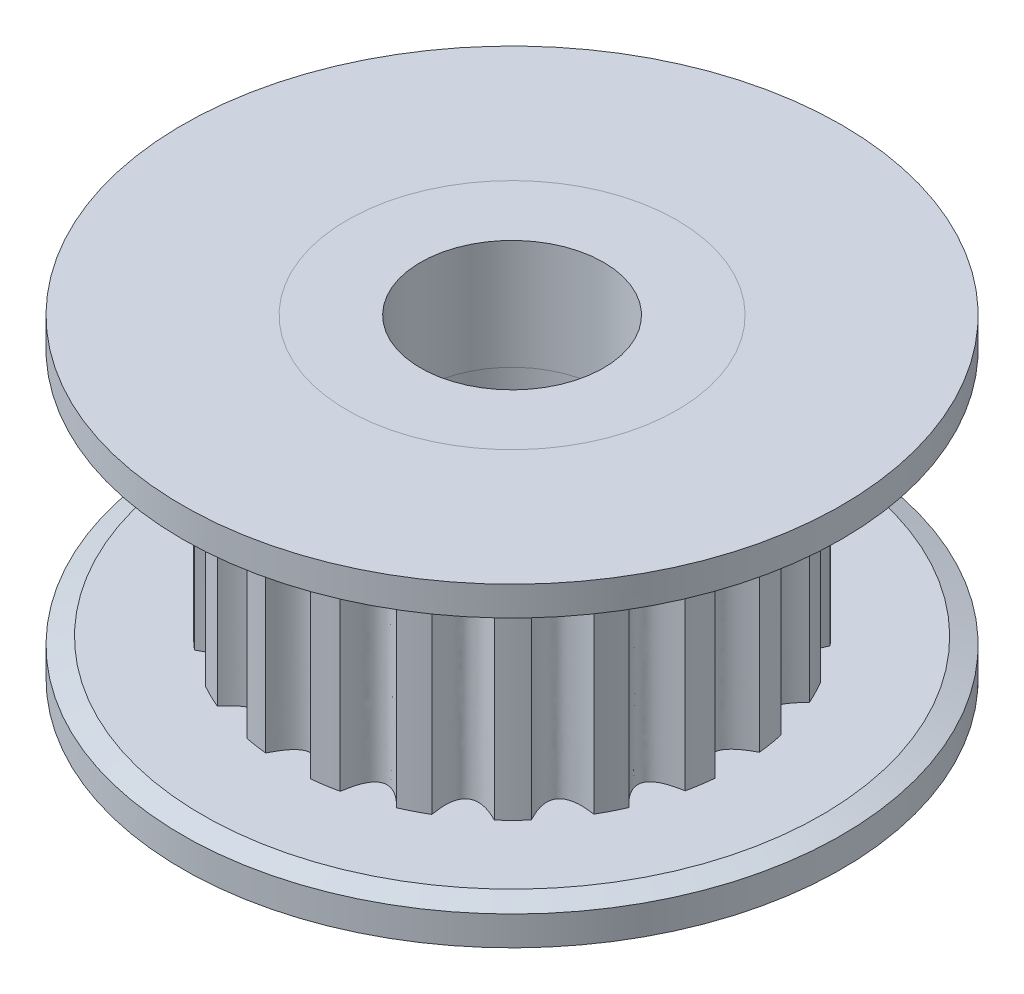
from build123d import *

# Parameters (mm, degrees)
CHANFRO1_SIZE         = 0.2
CHANFRO1_SIZE2        = 0.549495484
CHANFRO2_SIZE         = 0.2
CHANFRO2_SIZE2        = 0.549495484
ESBO_O2_W             = 2
ESBO_O2_H             = 3
CORTE_EXTRUS_O1_DEPTH = 6.6


with BuildPart() as part:
    # Esboço1 → Revolução1 (revolve)
    with BuildSketch(Plane.XY, mode=Mode.PRIVATE) as revolu_o1_sk:
        Polygon((-4.5, 0), (-9, 0), (-9, 1), (-6.15, 1), (-6.15, 7.6), (-9, 7.6), (-9, 8.6), (-4.5, 8.6), (-4.5, 5.6), (-2.5, 5.6), (-2.5, 3), (-4.5, 3), align=None)
    revolve(revolu_o1_sk.sketch.rotate(Axis((0, 0, 0), (0, 1, 0)), 270), axis=Axis((0, 0, 0), (0, 1, 0)))

    # Chanfro1
    chanfro1_edges = [part.edges().sort_by_distance(p)[0] for p in [
        (0, 1, 9),
    ]]
    chanfro1_side = [part.faces().sort_by_distance(p)[0] for p in [
        (0, 0.5, 9),
    ]]
    chamfer(chanfro1_edges, length=CHANFRO1_SIZE, length2=CHANFRO1_SIZE2, reference=chanfro1_side[0])

    # Chanfro2
    chanfro2_edges = [part.edges().sort_by_distance(p)[0] for p in [
        (0, 7.6, 9),
    ]]
    chanfro2_side = [part.faces().sort_by_distance(p)[0] for p in [
        (0, 8.1, 9),
    ]]
    chamfer(chanfro2_edges, length=CHANFRO2_SIZE, length2=CHANFRO2_SIZE2, reference=chanfro2_side[0])

    # Esboço3 → Corte-extrusão1 (cut)
    with BuildSketch(Plane.XZ.offset(-7.6)):
        with BuildLine():
            ThreePointArc((0.61126857, 6.119546612), (0, 6.15), (-0.61126857, 6.119546612))
            add(Edge.make_bspline(
                [(0.61126857, 6.119546612), (0, 4.880453388), (-0.61126857, 6.119546612)],
                knots=[0, 0, 0, 1, 1, 1], degree=2))
        make_face()
        with BuildLine():
            ThreePointArc((2.477563874, 5.62886998), (1.90582379, 5.847250267), (1.315209302, 6.007722072))
            add(Edge.make_bspline(
                [(2.477563874, 5.62886998), (1.507530289, 4.641762361), (1.315209302, 6.007722072)],
                knots=[0, 0, 0, 1, 1, 1], degree=2))
        make_face()
        with BuildLine():
            ThreePointArc((4.099930137, 4.58400184), (3.624009322, 4.968808351), (3.112197983, 5.304406066))
            add(Edge.make_bspline(
                [(4.099930137, 4.58400184), (2.867573845, 3.94904622), (3.112197983, 5.304406066)],
                knots=[0, 0, 0, 1, 1, 1], degree=2))
        make_face()
        with BuildLine():
            ThreePointArc((5.318636967, 3.087814892), (4.985392299, 3.601161427), (4.602774595, 4.078843712))
            add(Edge.make_bspline(
                [(5.318636967, 3.087814892), (3.947079313, 2.87008914), (4.602774595, 4.078843712)],
                knots=[0, 0, 0, 1, 1, 1], degree=2))
        make_face()
        with BuildLine():
            ThreePointArc((6.013696343, 1.287616518), (5.855937491, 1.878961442), (5.640184124, 2.451697994))
            add(Edge.make_bspline(
                [(6.013696343, 1.287616518), (4.640452509, 1.510466561), (5.640184124, 2.451697994)],
                knots=[0, 0, 0, 1, 1, 1], degree=2))
        make_face()
        with BuildLine():
            ThreePointArc((6.116676055, -0.639354395), (6.149935199, -0.028232064), (6.122288209, 0.583169864))
            add(Edge.make_bspline(
                [(6.116676055, -0.639354395), (4.879889539, 0.003209909), (6.122288209, 0.583169864)],
                knots=[0, 0, 0, 1, 1, 1], degree=2))
        make_face()
        with BuildLine():
            ThreePointArc((5.617437216, -2.503377544), (5.83843982, -1.932645976), (6.001621197, -1.34277437))
            add(Edge.make_bspline(
                [(5.617437216, -2.503377544), (4.642009607, -1.504215684), (6.001621197, -1.34277437)],
                knots=[0, 0, 0, 1, 1, 1], degree=2))
        make_face()
        with BuildLine():
            ThreePointArc((4.565132484, -4.120930162), (4.952119693, -3.646780847), (5.290063383, -3.136515488))
            add(Edge.make_bspline(
                [(4.565132484, -4.120930162), (3.950138384, -2.864345261), (5.290063383, -3.136515488)],
                knots=[0, 0, 0, 1, 1, 1], degree=2))
        make_face()
        with BuildLine():
            ThreePointArc((3.063366731, -5.332755786), (3.578237643, -5.001871187), (4.057671332, -4.621450353))
            add(Edge.make_bspline(
                [(3.063366731, -5.332755786), (2.872018914, -3.944146003), (4.057671332, -4.621450353)],
                knots=[0, 0, 0, 1, 1, 1], degree=2))
        make_face()
        with BuildLine():
            ThreePointArc((1.2599966, -6.019543884), (1.852059497, -5.86450131), (2.425780447, -5.651379409))
            add(Edge.make_bspline(
                [(1.2599966, -6.019543884), (1.513174901, -4.638034163), (2.425780447, -5.651379409)],
                knots=[0, 0, 0, 1, 1, 1], degree=2))
        make_face()
        with BuildLine():
            ThreePointArc((-0.667426746, -6.113676598), (-0.056463533, -6.149740797), (0.555058868, -6.124900787))
            add(Edge.make_bspline(
                [(-0.667426746, -6.113676598), (0.006576996, -4.878202716), (0.555058868, -6.124900787)],
                knots=[0, 0, 0, 1, 1, 1], degree=2))
        make_face()
        with BuildLine():
            ThreePointArc((-2.529138459, -5.605886072), (-1.959427435, -5.829506337), (-1.370311141, -5.995393847))
            add(Edge.make_bspline(
                [(-2.529138459, -5.605886072), (-1.500375367, -4.64124909), (-1.370311141, -5.995393847)],
                knots=[0, 0, 0, 1, 1, 1], degree=2))
        make_face()
        with BuildLine():
            ThreePointArc((-4.141843345, -4.546166925), (-3.669475521, -4.935326677), (-3.160766896, -5.275609219))
            add(Edge.make_bspline(
                [(-4.141843345, -4.546166925), (-2.860281353, -3.950454989), (-3.160766896, -5.275609219)],
                knots=[0, 0, 0, 1, 1, 1], degree=2))
        make_face()
        with BuildLine():
            ThreePointArc((-5.346762225, -3.038854013), (-5.018244668, -3.555238452), (-4.640028721, -4.036413442))
            add(Edge.make_bspline(
                [(-5.346762225, -3.038854013), (-3.940162474, -2.873496238), (-4.640028721, -4.036413442)],
                knots=[0, 0, 0, 1, 1, 1], degree=2))
        make_face()
        with BuildLine():
            ThreePointArc((-6.025264572, -1.232350129), (-5.872941544, -1.825118523), (-5.6624556, -2.399811781))
            add(Edge.make_bspline(
                [(-6.025264572, -1.232350129), (-4.634470584, -1.515808235), (-5.6624556, -2.399811781)],
                knots=[0, 0, 0, 1, 1, 1], degree=2))
        make_face()
        with BuildLine():
            ThreePointArc((-6.110548304, 0.695485032), (-6.149416798, 0.084693812), (-6.127384292, -0.526936176))
            add(Edge.make_bspline(
                [(-6.110548304, 0.695485032), (-4.875407146, -0.010257903), (-6.127384292, -0.526936176)],
                knots=[0, 0, 0, 1, 1, 1], degree=2))
        make_face()
        with BuildLine():
            ThreePointArc((-5.594216793, 2.554846076), (-5.820450005, 1.986167601), (-5.989040152, 1.397819035))
            add(Edge.make_bspline(
                [(-5.594216793, 2.554846076), (-4.63954452, 1.495865517), (-5.989040152, 1.397819035)],
                knots=[0, 0, 0, 1, 1, 1], degree=2))
        make_face()
        with BuildLine():
            ThreePointArc((-4.527105562, 4.162669244), (-4.918429655, 3.692092866), (-5.261043879, 3.184951695))
            add(Edge.make_bspline(
                [(-4.527105562, 4.162669244), (-3.950102511, 2.855266321), (-5.261043879, 3.184951695)],
                knots=[0, 0, 0, 1, 1, 1], degree=2))
        make_face()
        with BuildLine():
            ThreePointArc((-3.014277257, 5.360655988), (-3.53216434, 5.034512397), (-4.01507049, 4.658509307))
            add(Edge.make_bspline(
                [(-3.014277257, 5.360655988), (-2.874659117, 3.935053197), (-4.01507049, 4.658509307)],
                knots=[0, 0, 0, 1, 1, 1], degree=2))
        make_face()
        with BuildLine():
            ThreePointArc((-1.204677688, 6.030858286), (-1.798139087, 5.881258014), (-2.373792542, 5.673412462))
            add(Edge.make_bspline(
                [(-1.204677688, 6.030858286), (-1.518521518, 4.629734513), (-2.373792542, 5.673412462)],
                knots=[0, 0, 0, 1, 1, 1], degree=2))
        make_face()
    extrude(amount=CORTE_EXTRUS_O1_DEPTH, mode=Mode.SUBTRACT)


with BuildPart() as body_2:
    # Esboço2 → Revolução2 (revolve)
    with BuildSketch(Plane.XY, mode=Mode.PRIVATE) as revolu_o2_sk:
        with Locations((-3.5, 1.5)):
            Rectangle(ESBO_O2_W, ESBO_O2_H)
        with Locations((-3.5, 7.1)):
            Rectangle(ESBO_O2_W, ESBO_O2_H)
    revolve(revolu_o2_sk.sketch.rotate(Axis((0, 0, 0), (0, 1, 0)), 270), axis=Axis((0, 0, 0), (0, 1, 0)))


solid = Compound([part.part, body_2.part])
